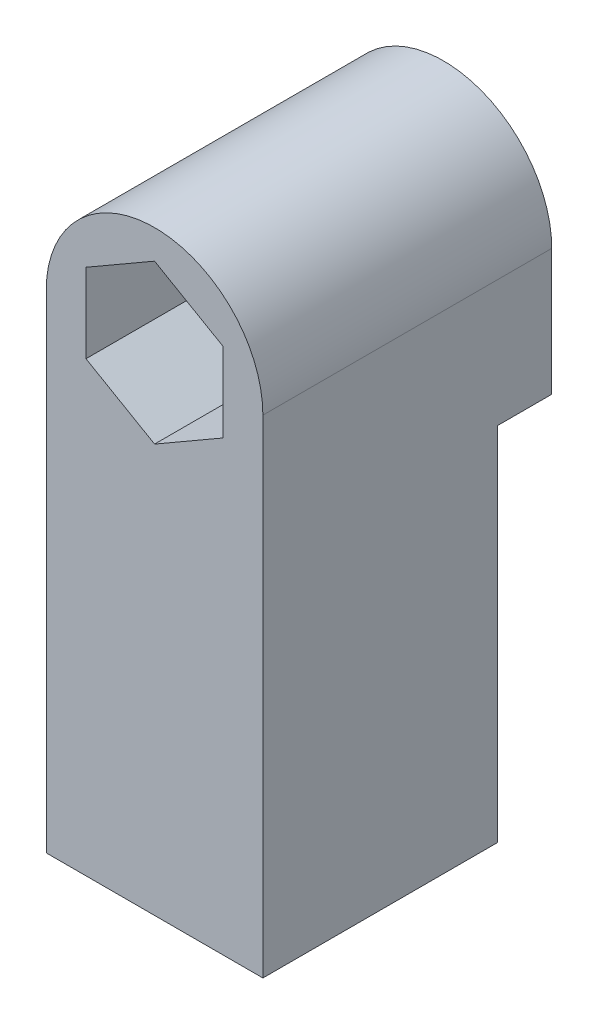
from build123d import *

# Parameters (mm, degrees)
RESSALTO_EXTRUS_O1_DEPTH = 16
CORTE_EXTRUS_O1_DEPTH    = 32.953090617
ESBO_O8_W                = 3
ESBO_O8_H                = 20
CORTE_EXTRUS_O4_DEPTH    = 34.600595233
ESBO_O5_R                = 1
CORTE_EXTRUS_O2_DEPTH    = 5


with BuildPart() as part:
    # Esboço1 → Ressalto-extrusão1 (new body)
    with BuildSketch(Plane.XY):
        with BuildLine():
            Line((-6, 0), (-6, -27))
            Line((-6, -27), (6, -27))
            Line((6, -27), (6, 0))
            ThreePointArc((6, 0), (0, 6), (-6, 0))
        make_face()
    extrude(amount=RESSALTO_EXTRUS_O1_DEPTH)

    # Esboço2 → Corte-extrusão1 (cut, through all)
    with BuildSketch(Plane.XY.offset(16)):
        Polygon((0, 4.387862046), (-3.8, 2.193931023), (-3.8, -2.193931023), (0, -4.387862046), (3.8, -2.193931023), (3.8, 2.193931023), align=None)
    extrude(amount=-CORTE_EXTRUS_O1_DEPTH, mode=Mode.SUBTRACT)

    # Esboço8 → Corte-extrusão4 (cut, through all)
    with BuildSketch(Plane(origin=(6, 0, 0), x_dir=(0, 0, -1), z_dir=(1, 0, 0))):
        with Locations((-1.5, -17)):
            Rectangle(ESBO_O8_W, ESBO_O8_H)
    extrude(amount=-CORTE_EXTRUS_O4_DEPTH, mode=Mode.SUBTRACT)

    # Esboço5 → Corte-extrusão2 (cut)
    with BuildSketch(Plane.XZ.offset(27)):
        with Locations(Location((0, 13.5, 0), (0, 0, 270))):
            Circle(ESBO_O5_R)
        with Locations(Location((0, 5.5, 0), (0, 0, 270))):
            Circle(ESBO_O5_R)
    extrude(amount=-CORTE_EXTRUS_O2_DEPTH, mode=Mode.SUBTRACT)


solid = part.part
